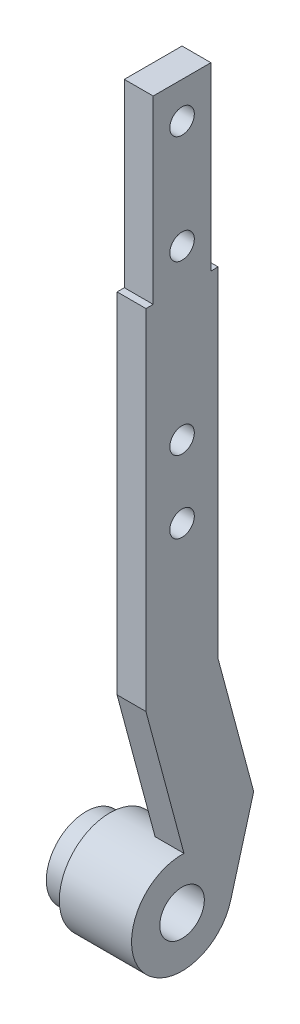
from build123d import *

# Parameters (mm, degrees)
SKETCH1_R           = 7
SKETCH1_R_2         = 3.0845
BOSS_EXTRUDE1_DEPTH = 10
BOSS_EXTRUDE2_START = 7
SKETCH1_3_R         = 7
BOSS_EXTRUDE2_DEPTH = 3
SKETCH1_5_R         = 1.7
BOSS_EXTRUDE3_DEPTH = 4
SKETCH2_R           = 5.5
SKETCH2_R_2         = 3.5
BOSS_EXTRUDE4_DEPTH = 3.305
SKETCH3_R           = 1.7
CUT_EXTRUDE1_DEPTH  = 4


with BuildPart() as part:
    # Sketch1 → Boss-Extrude1 (new body)
    with BuildSketch(Plane.ZY.offset(20.145)):
        Circle(SKETCH1_R)
        Circle(SKETCH1_R_2, mode=Mode.SUBTRACT)
    extrude(amount=BOSS_EXTRUDE1_DEPTH)

    # Sketch1<3> → Boss-Extrude2 (add)
    with BuildSketch(Plane.ZY.offset(20.145).offset(BOSS_EXTRUDE2_START)):
        Circle(SKETCH1_3_R)
    extrude(amount=BOSS_EXTRUDE2_DEPTH)

    # Sketch1<5> → Boss-Extrude3 (add)
    with BuildSketch(Plane.ZY.offset(20.145)):
        with BuildLine():
            Line((-5, 75), (-5, 27.967015644))
            Line((-5, 27.967015644), (-9.925953163, 9.583108165))
            Line((-9.925953163, 9.583108165), (-6.744787083, -1.872924772))
            ThreePointArc((-6.744787083, -1.872924772), (-5.652422268, 4.129179399), (-0.2666949, 6.994917714))
            Line((-0.2666949, 6.994917714), (5, 26.650490668))
            Line((5, 26.650490668), (5, 75))
            Line((5, 75), (4, 75))
            Line((4, 75), (4, 100))
            Line((4, 100), (-4, 100))
            Line((-4, 100), (-4, 75))
            Line((-4, 75), (-5, 75))
        make_face()
        with Locations((0, 80)):
            Circle(SKETCH1_5_R, mode=Mode.SUBTRACT)
        with Locations((0, 95)):
            Circle(SKETCH1_5_R, mode=Mode.SUBTRACT)
    extrude(amount=BOSS_EXTRUDE3_DEPTH)

    # Sketch2 → Boss-Extrude4 (add)
    with BuildSketch(Plane.ZY.offset(30.145)):
        Circle(SKETCH2_R)
        Circle(SKETCH2_R_2, mode=Mode.SUBTRACT)
    extrude(amount=BOSS_EXTRUDE4_DEPTH)

    # Sketch3 → Cut-Extrude1 (cut)
    with BuildSketch(Plane(origin=(-20.145, 0, 0), x_dir=(0, 0, -1), z_dir=(1, 0, 0))):
        with Locations((0, 46.747966087)):
            Circle(SKETCH3_R)
        with Locations((0, 56.747966087)):
            Circle(SKETCH3_R)
    extrude(amount=-CUT_EXTRUDE1_DEPTH, mode=Mode.SUBTRACT)


solid = part.part
